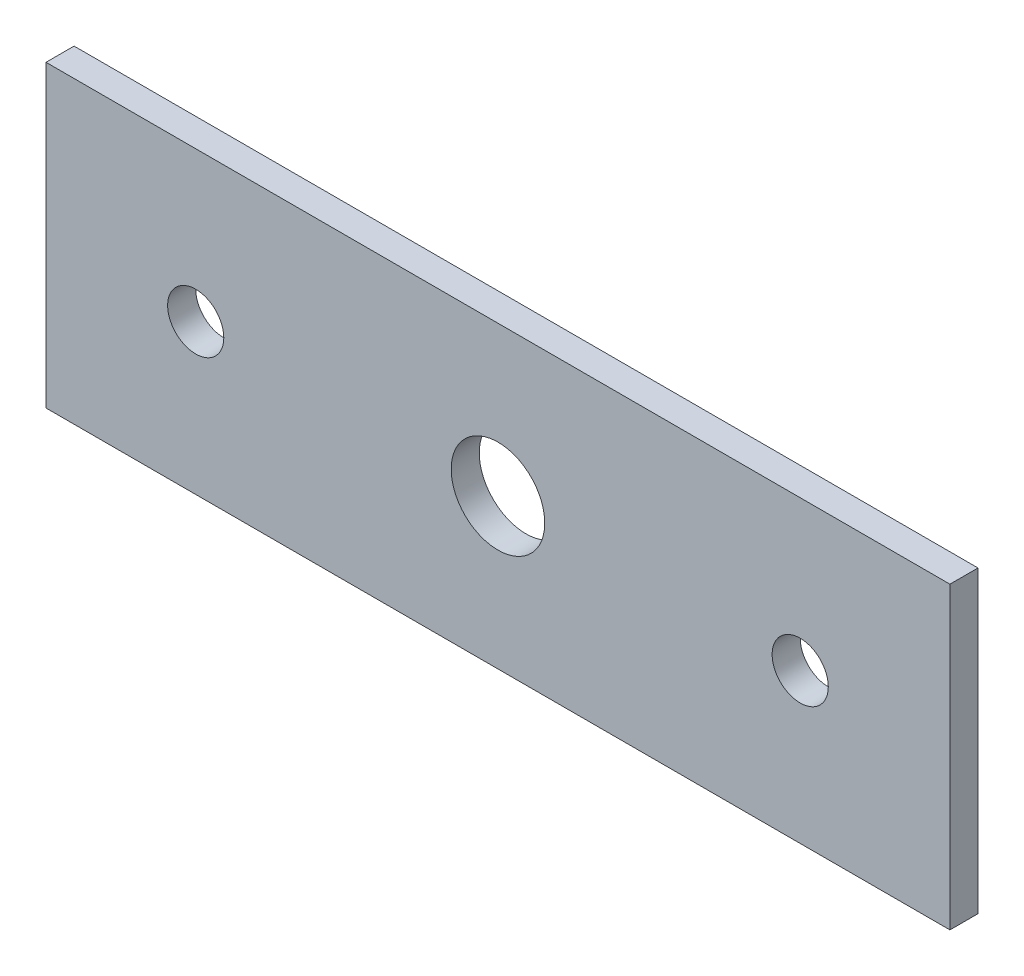
from build123d import *

# Parameters (mm, degrees)
SKETCH1_W           = 96.6
SKETCH1_H           = 32
BOSS_EXTRUDE1_DEPTH = 3
SKETCH2_R           = 3
SKETCH2_R_2         = 5
CUT_EXTRUDE1_DEPTH  = 79.565348097


with BuildPart() as part:
    # Sketch1 → Boss-Extrude1 (new body)
    with BuildSketch(Plane.XY):
        with Locations((28.417538555, 0.671328671)):
            Rectangle(SKETCH1_W, SKETCH1_H)
    extrude(amount=BOSS_EXTRUDE1_DEPTH)

    # Sketch2 → Cut-Extrude1 (cut, through all)
    with BuildSketch(Plane.XY.offset(3)):
        with Locations((-3.882461445, 0.671328671)):
            Circle(SKETCH2_R)
        with Locations((60.717538555, 0.671328671)):
            Circle(SKETCH2_R)
        with Locations((28.417538555, 0.671328671)):
            Circle(SKETCH2_R_2)
    extrude(amount=-CUT_EXTRUDE1_DEPTH, mode=Mode.SUBTRACT)


solid = part.part
